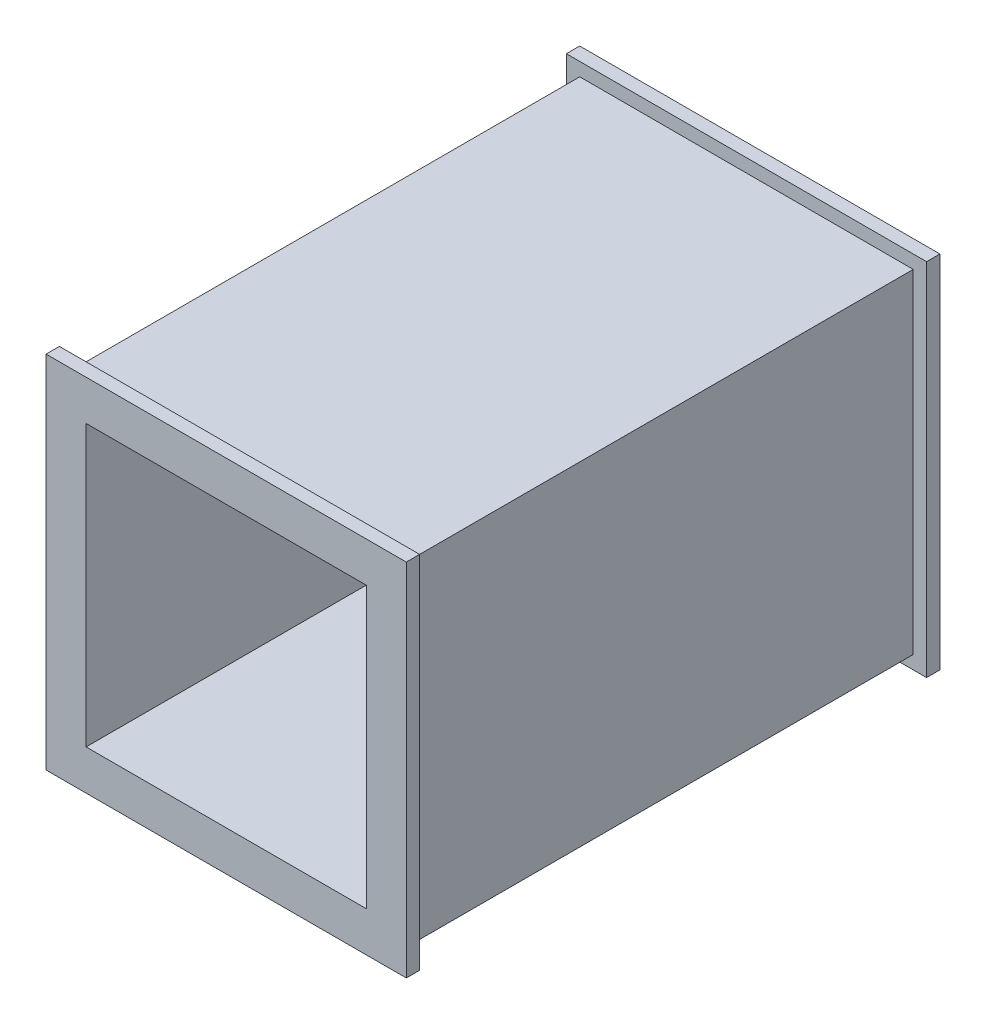
from build123d import *

# Parameters (mm, degrees)
SKETCH1_W           = 125
SKETCH1_H           = 125
BOSS_EXTRUDE1_DEPTH = 200
SHELL1_T            = -10
SKETCH2_W           = 135
SKETCH2_H           = 135
SKETCH2_W_2         = 125
SKETCH2_H_2         = 125
SKETCH2_W_3         = 105
SKETCH2_H_3         = 105
BOSS_EXTRUDE2_DEPTH = 5
SKETCH3_W           = 135
SKETCH3_H           = 135
SKETCH3_W_2         = 125
SKETCH3_H_2         = 125
SKETCH3_W_3         = 105
SKETCH3_H_3         = 105
BOSS_EXTRUDE3_DEPTH = 5


with BuildPart() as part:
    # Sketch1 → Boss-Extrude1 (new body)
    with BuildSketch(Plane.XY):
        Rectangle(SKETCH1_W, SKETCH1_H)
    extrude(amount=BOSS_EXTRUDE1_DEPTH)

    # Shell1
    shell1_openings = [part.faces().sort_by_distance(p)[0] for p in [
        (0, 0, 200),
        (0, 0, 0),
    ]]
    offset(amount=SHELL1_T, openings=shell1_openings, kind=Kind.INTERSECTION)

    # Sketch2 → Boss-Extrude2 (add)
    # profile 1 of 2: a face of its own
    with BuildSketch(Plane.XY.offset(200)):
        Rectangle(SKETCH2_W, SKETCH2_H)
        Rectangle(SKETCH2_W_2, SKETCH2_H_2, mode=Mode.SUBTRACT)
    # profile 2 of 2: a face of its own
    with BuildSketch(Plane.XY.offset(200)):
        Rectangle(SKETCH2_W_2, SKETCH2_H_2)
        Rectangle(SKETCH2_W_3, SKETCH2_H_3, mode=Mode.SUBTRACT)
    extrude(amount=-BOSS_EXTRUDE2_DEPTH)

    # Sketch3 → Boss-Extrude3 (add)
    # profile 1 of 2: a face of its own
    with BuildSketch(Plane(origin=(0, 0, 0), x_dir=(-1, 0, 0), z_dir=(0, 0, -1))):
        Rectangle(SKETCH3_W, SKETCH3_H)
        Rectangle(SKETCH3_W_2, SKETCH3_H_2, mode=Mode.SUBTRACT)
    # profile 2 of 2: a face of its own
    with BuildSketch(Plane(origin=(0, 0, 0), x_dir=(-1, 0, 0), z_dir=(0, 0, -1))):
        Rectangle(SKETCH3_W_2, SKETCH3_H_2)
        Rectangle(SKETCH3_W_3, SKETCH3_H_3, mode=Mode.SUBTRACT)
    extrude(amount=-BOSS_EXTRUDE3_DEPTH)


solid = part.part
